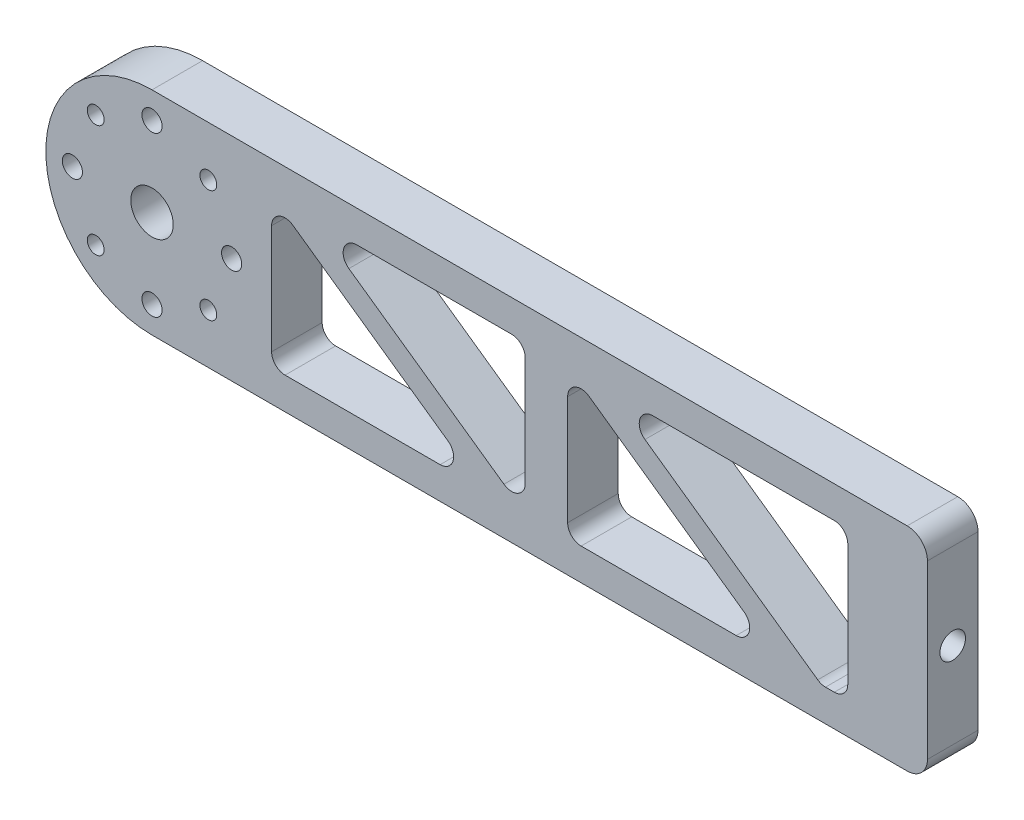
from build123d import *

# Parameters (mm, degrees)
SKETCH1_R           = 4
BOSS_EXTRUDE1_DEPTH = 9.525
SKETCH3_R           = 1.89865
SKETCH3_R_2         = 1.5875
CUT_EXTRUDE2_DEPTH  = 96.626232018
CUT_EXTRUDE6_DEPTH  = 96.626232018
FILLET1_R           = 2.54
CUT_EXTRUDE10_REACH = 169.521
SKETCH18_R          = 2.413
FILLET2_R           = 3.81


with BuildPart() as part:
    # Sketch1 → Boss-Extrude1 (new body)
    with BuildSketch(Plane.XY):
        with BuildLine():
            Line((-73.025, 20), (73.025, 20))
            Line((73.025, 20), (73.025, -20))
            Line((73.025, -20), (-73.025, -20))
            ThreePointArc((-73.025, -20), (-93.025, 0), (-73.025, 20))
        make_face()
        with Locations(Location((-73.025, 0, 0), (0, 0, 180))):
            Circle(SKETCH1_R, mode=Mode.SUBTRACT)
    extrude(amount=BOSS_EXTRUDE1_DEPTH)

    # Sketch3 → Cut-Extrude2 (cut, through all)
    with BuildSketch(Plane.XY):
        with Locations(Location((-73.025, 15, 0), (0, 0, 180))):
            Circle(SKETCH3_R)
        with Locations(Location((-58.025, 0, 0), (0, 0, 180))):
            Circle(SKETCH3_R)
        with Locations(Location((-73.025, -15, 0), (0, 0, 180))):
            Circle(SKETCH3_R)
        with Locations(Location((-88.025, 0, 0), (0, 0, 180))):
            Circle(SKETCH3_R)
        with Locations(Location((-83.631601718, 10.606601718, 0), (0, 0, 180))):
            Circle(SKETCH3_R_2)
        with Locations(Location((-62.418398282, 10.606601718, 0), (0, 0, 180))):
            Circle(SKETCH3_R_2)
        with Locations(Location((-62.418398282, -10.606601718, 0), (0, 0, 180))):
            Circle(SKETCH3_R_2)
        with Locations(Location((-83.631601718, -10.606601718, 0), (0, 0, 180))):
            Circle(SKETCH3_R_2)
    extrude(amount=CUT_EXTRUDE2_DEPTH, mode=Mode.SUBTRACT)

    # Sketch8 → Cut-Extrude6 (cut, through all)
    with BuildSketch(Plane.XY.offset(9.525)):
        Polygon((-50.501, 14), (-50.501, -14), (-10.738, -14), align=None)
        Polygon((-42.501, 14), (-2.738, -14), (-2.738, 14), align=None)
        Polygon((53.025, 14), (13.262, 14), (53.025, -14), (58.025, -14), (58.025, 14), align=None)
        Polygon((45.025, -14), (5.262, 14), (5.262, -14), align=None)
    extrude(amount=-CUT_EXTRUDE6_DEPTH, mode=Mode.SUBTRACT)

    # Fillet1
    fillet1_edges = [part.edges().sort_by_distance(p)[0] for p in [
        (58.025, -14, 4.7625),
        (53.025, -14, 4.7625),
        (13.262, 14, 4.7625),
        (58.025, 14, 4.7625),
        (5.262, -14, 4.7625),
        (5.262, 14, 4.7625),
        (45.025, -14, 4.7625),
        (-50.501, 14, 4.7625),
        (-10.738, -14, 4.7625),
        (-50.501, -14, 4.7625),
        (-2.738, 14, 4.7625),
        (-2.738, -14, 4.7625),
        (-42.501, 14, 4.7625),
    ]]
    fillet(fillet1_edges, radius=FILLET1_R)

    # Sketch18 → Cut-Extrude10 (cut, up to next)
    with BuildSketch(Plane(origin=(73.025, 0, 0), x_dir=(0, 0, -1), z_dir=(1, 0, 0)), mode=Mode.PRIVATE) as cut_extrude10_sk1:
        with Locations((-4.7625, 0)):
            Circle(SKETCH18_R)
    cut_extrude10_tool1 = extrude(cut_extrude10_sk1.sketch, amount=-CUT_EXTRUDE10_REACH, mode=Mode.PRIVATE) & part.part
    add(cut_extrude10_tool1.solids().sort_by_distance((73.025, 0, 4.7625))[0], mode=Mode.SUBTRACT)

    # Fillet2
    fillet2_edges = [part.edges().sort_by_distance(p)[0] for p in [
        (73.025, -20, 4.7625),
        (73.025, 20, 4.7625),
    ]]
    fillet(fillet2_edges, radius=FILLET2_R)


solid = part.part
